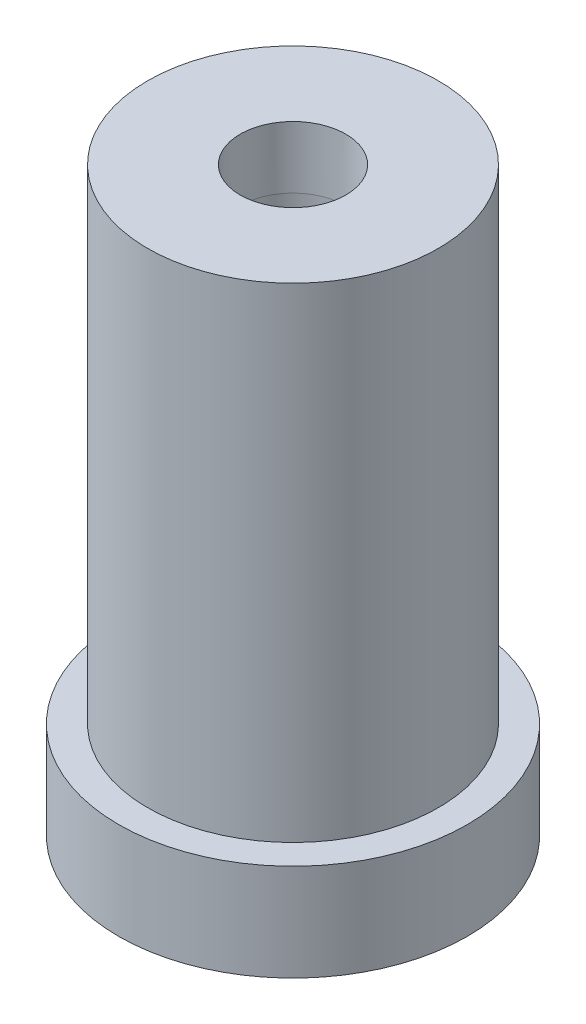
from build123d import *

# Parameters (mm, degrees)
CUT_EXTRUDE1_REACH = 34.588
SKETCH2_R          = 2.725


with BuildPart() as part:
    # Sketch1 → Revolve1 (revolve)
    with BuildSketch(Plane.XY, mode=Mode.PRIVATE) as revolve1_sk:
        Polygon((0, 0), (9, 0), (9, 5), (7.5, 5), (7.5, 30), (0, 30), align=None)
    revolve(revolve1_sk.sketch.rotate(Axis((0, 35, 0), (0, -1, 0)), 180), axis=Axis((0, 35, 0), (0, -1, 0)))

    # Sketch2 → Cut-Extrude1 (cut, up to next)
    with BuildSketch(Plane(origin=(0, 30, 0), x_dir=(1, 0, 0), z_dir=(0, 1, 0)), mode=Mode.PRIVATE) as cut_extrude1_sk1:
        with Locations(Location((0, 0, 0), (0, 0, 270))):
            Circle(SKETCH2_R)
    cut_extrude1_tool1 = extrude(cut_extrude1_sk1.sketch, amount=-CUT_EXTRUDE1_REACH, mode=Mode.PRIVATE) & part.part
    add(cut_extrude1_tool1.solids().sort_by_distance((0, 30, 0))[0], mode=Mode.SUBTRACT)

    # Cut-Sweep1: sweep along a curve in space
    with BuildLine() as cut_sweep1_path:
        ThreePointArc((0, 30, 2.725), (1.926865979, 30, 1.926865979), (2.725, 30, 0))
        ThreePointArc((2.725, 30, 0), (1.926865979, 30, -1.926865979), (0, 30, -2.725))
        ThreePointArc((0, 30, -2.725), (-1.926865979, 30, -1.926865979), (-2.725, 30, 0))
        ThreePointArc((-2.725, 30, 0), (-1.926865979, 30, 1.926865979), (0, 30, 2.725))
    # Sketch3 → Cut-Sweep1 (sweep, cut)
    with BuildSketch(Plane.XY):
        Polygon((2.725, 26.8), (3.426782698, 0), (2.725, 0), align=None)
    sweep(path=cut_sweep1_path.line, mode=Mode.SUBTRACT)


solid = part.part
